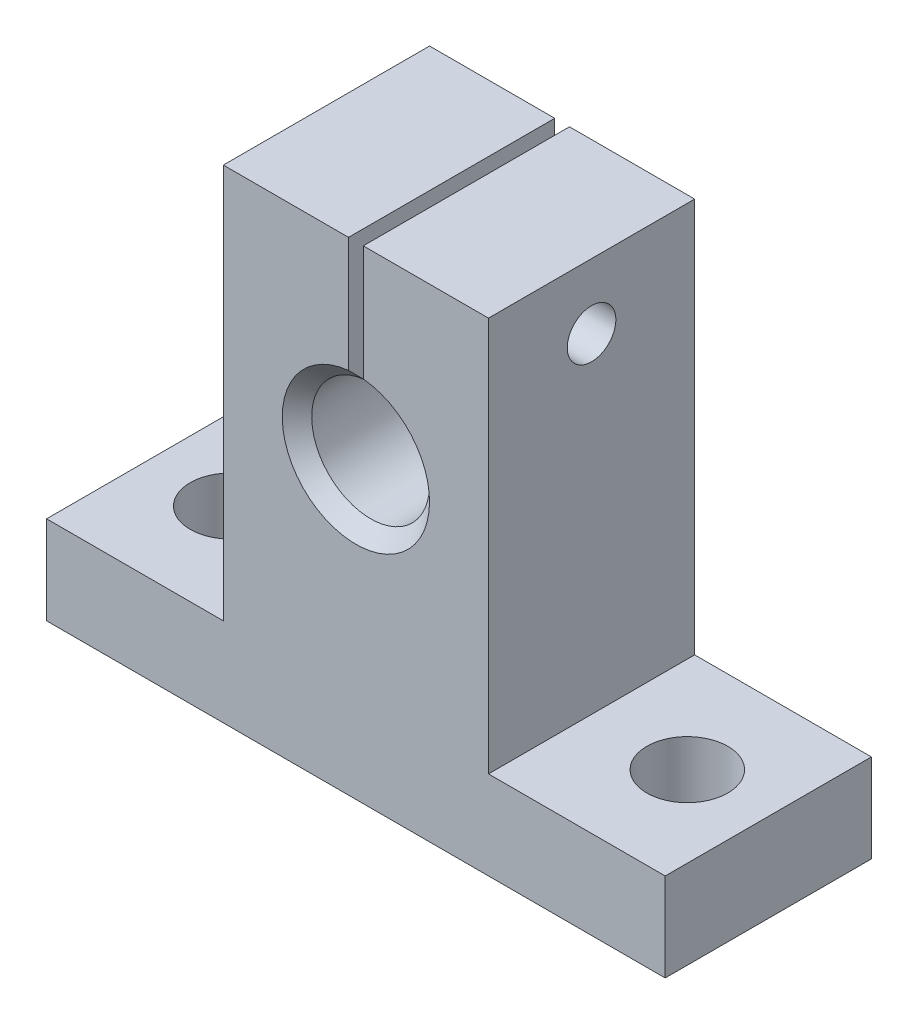
from build123d import *

# Parameters (mm, degrees)
BOSS_EXTRUDE1_DEPTH                                 = 14
SKETCH2_R                                           = 4
CUT_EXTRUDE1_DEPTH                                  = 42.386471219
SKETCH3_W                                           = 1
SKETCH3_H                                           = 15
CUT_EXTRUDE2_DEPTH                                  = 42.386471219
SKETCH4_R                                           = 2.75
CUT_EXTRUDE3_DEPTH                                  = 37.813584449
CHAMFER1_SIZE                                       = 1
CBORE_FOR_M4_HEX_SOCKET_HEAD_CAP_SCREW1_D           = 4.5
CBORE_FOR_M4_HEX_SOCKET_HEAD_CAP_SCREW1_DEPTH       = 10.1
CBORE_FOR_M4_HEX_SOCKET_HEAD_CAP_SCREW1_CBORE_D     = 7.5
CBORE_FOR_M4_HEX_SOCKET_HEAD_CAP_SCREW1_CBORE_DEPTH = 4.4
CBORE_FOR_M4_HEX_SOCKET_HEAD_CAP_SCREW1_TIP         = 1.351936393
M4_TAPPED_HOLE1_D                                   = 3.3
M4_TAPPED_HOLE1_DEPTH                               = 10.1
M4_TAPPED_HOLE1_TIP                                 = 0.991420021
CUT_EXTRUDE5_DEPTH                                  = 1


with BuildPart() as part:
    # Sketch1 → Boss-Extrude1 (new body)
    with BuildSketch(Plane.XY):
        Polygon((21, 0), (-21, 0), (-21, 6), (-9, 6), (-9, 32.8), (9, 32.8), (9, 6), (21, 6), align=None)
    extrude(amount=BOSS_EXTRUDE1_DEPTH)

    # Sketch2 → Cut-Extrude1 (cut, through all)
    with BuildSketch(Plane.XY.offset(14)):
        with Locations((0, 20)):
            Circle(SKETCH2_R)
    extrude(amount=-CUT_EXTRUDE1_DEPTH, mode=Mode.SUBTRACT)

    # Sketch3 → Cut-Extrude2 (cut, through all)
    with BuildSketch(Plane.XY.offset(14)):
        with Locations((0, 28.4)):
            Rectangle(SKETCH3_W, SKETCH3_H)
    extrude(amount=-CUT_EXTRUDE2_DEPTH, mode=Mode.SUBTRACT)

    # Sketch4 → Cut-Extrude3 (cut, through all)
    with BuildSketch(Plane(origin=(0, 6, 0), x_dir=(1, 0, 0), z_dir=(0, 1, 0))):
        with Locations(Location((-15.5, -7, 0), (0, 0, 270))):
            Circle(SKETCH4_R)
        with Locations(Location((15.5, -7, 0), (0, 0, 90))):
            Circle(SKETCH4_R)
    extrude(amount=-CUT_EXTRUDE3_DEPTH, mode=Mode.SUBTRACT)

    # Chamfer1
    chamfer1_edges = [part.edges().sort_by_distance(p)[0] for p in [
        (0, 16, 0),
        (0, 16, 14),
    ]]
    chamfer(chamfer1_edges, length=CHAMFER1_SIZE)

    # CBORE for M4 Hex Socket Head Cap Screw1
    with Locations(Plane.ZY.offset(9)):
        with Locations((7, 28.384313483)):
            CounterBoreHole(CBORE_FOR_M4_HEX_SOCKET_HEAD_CAP_SCREW1_D / 2, CBORE_FOR_M4_HEX_SOCKET_HEAD_CAP_SCREW1_CBORE_D / 2, CBORE_FOR_M4_HEX_SOCKET_HEAD_CAP_SCREW1_CBORE_DEPTH, depth=CBORE_FOR_M4_HEX_SOCKET_HEAD_CAP_SCREW1_DEPTH)
            with Locations((0, 0, -(CBORE_FOR_M4_HEX_SOCKET_HEAD_CAP_SCREW1_DEPTH + CBORE_FOR_M4_HEX_SOCKET_HEAD_CAP_SCREW1_TIP / 2))):  # 118° drill point
                Cone(0, CBORE_FOR_M4_HEX_SOCKET_HEAD_CAP_SCREW1_D / 2, CBORE_FOR_M4_HEX_SOCKET_HEAD_CAP_SCREW1_TIP, mode=Mode.SUBTRACT)

    # M4 Tapped Hole1
    with Locations(Plane.ZY.offset(-0.5)):
        with Locations((7, 28.384313483)):
            Hole(M4_TAPPED_HOLE1_D / 2, depth=M4_TAPPED_HOLE1_DEPTH)
            with Locations((0, 0, -(M4_TAPPED_HOLE1_DEPTH + M4_TAPPED_HOLE1_TIP / 2))):  # 118° drill point
                Cone(0, M4_TAPPED_HOLE1_D / 2, M4_TAPPED_HOLE1_TIP, mode=Mode.SUBTRACT)

    # Sketch13 → Cut-Extrude5 (cut)
    # profile 1 of 3: a face of its own
    with BuildSketch(Plane.ZY.offset(9)):
        with BuildLine():
            Line((3.096153846, 11.716348379), (3.392027244, 11.893732193))
            add(Edge.make_bspline(
                [(3.392027244, 11.893732193), (3.419545481, 11.847667808), (3.472269361, 11.759410224), (3.560220721, 11.640152184), (3.651353632, 11.538790027), (3.746342965, 11.45591342), (3.844608913, 11.390664533), (3.946792967, 11.344462301), (4.052550778, 11.315646326), (4.124524599, 11.312146239), (4.160456731, 11.31039886)],
                knots=[0, 0, 0, 0, 1.272034388, 2.437168799, 3.508375237, 4.49857839, 5.41946034, 6.295179144, 7.148887113, 8, 8, 8, 8], degree=3))
            add(Edge.make_bspline(
                [(4.160456731, 11.31039886), (4.191143591, 11.311253532), (4.251980364, 11.312947923), (4.341542607, 11.329228725), (4.42852441, 11.354240854), (4.511133047, 11.390061785), (4.588228662, 11.433400271), (4.655835357, 11.485746448), (4.71428147, 11.544352654), (4.762090585, 11.609735309), (4.79877062, 11.680052457), (4.826962689, 11.752228409), (4.842607762, 11.827396977), (4.844964516, 11.87800744), (4.846153846, 11.903547898)],
                knots=[0, 0, 0, 0, 1.095163259, 2.171163733, 3.241058638, 4.321873601, 5.38011039, 6.391990106, 7.366004449, 8.327778327, 9.272591725, 10.192022065, 11.087607919, 12, 12, 12, 12], degree=3))
            add(Edge.make_bspline(
                [(4.846153846, 11.903547898), (4.844679535, 11.932688748), (4.841682477, 11.991927837), (4.816350997, 12.07932749), (4.77650175, 12.16582006), (4.739739107, 12.219321326), (4.720653045, 12.247097578)],
                knots=[0, 0, 0, 0, 0.938893495, 1.908633276, 2.914225137, 4, 4, 4, 4], degree=3))
            add(Edge.make_bspline(
                [(4.720653045, 12.247097578), (4.704982431, 12.267144401), (4.672083936, 12.3092302), (4.615526424, 12.371875436), (4.54916031, 12.436493854), (4.475256755, 12.505552911), (4.391123666, 12.575840708), (4.299396151, 12.650708986), (4.197732292, 12.727310563), (4.126432796, 12.778683129), (4.089643429, 12.805190527)],
                knots=[0, 0, 0, 0, 0.722233717, 1.516239348, 2.393582979, 3.351407094, 4.387010283, 5.505090956, 6.712668013, 8, 8, 8, 8], degree=3))
            add(Edge.make_bspline(
                [(4.089643429, 12.805190527), (4.052819433, 12.831419114), (3.982414757, 12.881566176), (3.883956174, 12.95599046), (3.795911711, 13.02403433), (3.718672695, 13.086338342), (3.652273098, 13.142910947), (3.596189687, 13.193208886), (3.55185113, 13.238592447), (3.527195549, 13.268033789), (3.516125801, 13.281252225)],
                knots=[0, 0, 0, 0, 1.452282411, 2.77665338, 3.964542531, 5.026858415, 5.96415736, 6.766646006, 7.446254459, 8, 8, 8, 8], degree=3))
            add(Edge.make_bspline(
                [(3.516125801, 13.281252225), (3.500653256, 13.301853262), (3.470224419, 13.342367966), (3.430058414, 13.405692824), (3.395919251, 13.470516089), (3.369156919, 13.537011954), (3.3466207, 13.604246883), (3.331462769, 13.673098128), (3.321971372, 13.743256747), (3.320999386, 13.790470247), (3.320512821, 13.814104789)],
                knots=[0, 0, 0, 0, 1.068054152, 2.10047183, 3.106115577, 4.101338837, 5.06977816, 6.043150881, 7.020423561, 8, 8, 8, 8], degree=3))
            add(Edge.make_bspline(
                [(3.320512821, 13.814104789), (3.32181803, 13.851134564), (3.32440055, 13.924402628), (3.346241067, 14.031433458), (3.38071396, 14.133619875), (3.429008848, 14.229950209), (3.491266201, 14.31791619), (3.563312176, 14.398529677), (3.649123662, 14.466298259), (3.743276285, 14.525510318), (3.846332657, 14.571856243), (3.954323561, 14.606817223), (4.067420633, 14.626626481), (4.144023767, 14.629469246), (4.182892628, 14.63091168)],
                knots=[0, 0, 0, 0, 1.005424448, 1.989358655, 2.955360095, 3.929531133, 4.905563448, 5.876582895, 6.856512386, 7.866279853, 8.892233794, 9.918561126, 10.94386622, 12, 12, 12, 12], degree=3))
            add(Edge.make_bspline(
                [(4.182892628, 14.63091168), (4.224136729, 14.629489129), (4.30615808, 14.626660128), (4.426807296, 14.602062596), (4.542968012, 14.561361925), (4.636411277, 14.515173267), (4.709544039, 14.469041851), (4.765316771, 14.427022027), (4.821834222, 14.378646918), (4.879552277, 14.323787672), (4.937492936, 14.261940921), (4.996516388, 14.193530232), (5.056760657, 14.118973676), (5.095516517, 14.065749175), (5.115384615, 14.038463764)],
                knots=[0, 0, 0, 0, 1.286793592, 2.559021753, 3.825965368, 5.121522368, 5.803751409, 6.523245864, 7.299691795, 8.125521123, 9.008227632, 9.944561021, 10.946284179, 12, 12, 12, 12], degree=3))
            Line((5.115384615, 14.038463764), (4.831430288, 13.823219373))
            add(Edge.make_bspline(
                [(4.831430288, 13.823219373), (4.814284356, 13.845308063), (4.781265299, 13.887845716), (4.731135812, 13.947417032), (4.683887164, 14.001833512), (4.637336764, 14.04909864), (4.593943133, 14.091800773), (4.551826091, 14.12836053), (4.511591739, 14.159136125), (4.460874829, 14.191979685), (4.39715711, 14.224536189), (4.317172574, 14.252085267), (4.233586299, 14.268640329), (4.176656668, 14.270829216), (4.147836538, 14.271937321)],
                knots=[0, 0, 0, 0, 1.181633172, 2.275549214, 3.290209073, 4.226197932, 5.078386478, 5.862611352, 6.581680152, 7.217281963, 8.414376989, 9.595101626, 10.782541182, 12, 12, 12, 12], degree=3))
            add(Edge.make_bspline(
                [(4.147836538, 14.271937321), (4.111680016, 14.270725622), (4.041955569, 14.268388972), (3.942965333, 14.242868987), (3.853871407, 14.202687127), (3.777318842, 14.146372149), (3.713581865, 14.079651156), (3.667476407, 14.002872301), (3.639726242, 13.918089898), (3.636339962, 13.858948242), (3.634615385, 13.828828347)],
                knots=[0, 0, 0, 0, 1.14458467, 2.207223713, 3.21896685, 4.227309161, 5.202851033, 6.127160689, 7.046193047, 8, 8, 8, 8], degree=3))
            add(Edge.make_bspline(
                [(3.634615385, 13.828828347), (3.635008511, 13.810076869), (3.635795407, 13.772543249), (3.646770205, 13.717091827), (3.660869534, 13.661780488), (3.683212166, 13.606857905), (3.714057469, 13.551363546), (3.754562645, 13.494341808), (3.805575957, 13.4352901), (3.84465297, 13.396882726), (3.865284455, 13.376604789)],
                knots=[0, 0, 0, 0, 0.858281714, 1.717966888, 2.583508476, 3.4729293, 4.427298488, 5.488583878, 6.674047936, 8, 8, 8, 8], degree=3))
            add(Edge.make_bspline(
                [(3.865284455, 13.376604789), (3.872945828, 13.369767764), (3.891147495, 13.353524555), (3.92442342, 13.326932275), (3.968366219, 13.294129502), (4.02182842, 13.253542186), (4.085795782, 13.206460724), (4.160275338, 13.153487112), (4.244436871, 13.092901653), (4.304158786, 13.050544112), (4.335737179, 13.028147257)],
                knots=[0, 0, 0, 0, 0.420754252, 0.999615792, 1.744751191, 2.668019286, 3.750313428, 4.999500688, 6.413464383, 8, 8, 8, 8], degree=3))
            add(Edge.make_bspline(
                [(4.335737179, 13.028147257), (4.373723093, 13.000505898), (4.447277549, 12.946982236), (4.551935129, 12.866566556), (4.646828937, 12.787918787), (4.732292141, 12.71154118), (4.809169049, 12.638013087), (4.87660677, 12.566449907), (4.93529245, 12.497364334), (4.998471669, 12.408791759), (5.063029488, 12.300010674), (5.118470996, 12.166732436), (5.153429343, 12.032936115), (5.158000859, 11.943009279), (5.16025641, 11.898640046)],
                knots=[0, 0, 0, 0, 1.163667725, 2.253281268, 3.268753668, 4.215851969, 5.092017293, 5.902905408, 6.650798638, 7.335211899, 8.59617414, 9.77448103, 10.901945474, 12, 12, 12, 12], degree=3))
            add(Edge.make_bspline(
                [(5.16025641, 11.898640046), (5.159599272, 11.867261681), (5.158297757, 11.805114297), (5.143336843, 11.71385922), (5.121417178, 11.625228351), (5.088379944, 11.540317238), (5.048056786, 11.457572475), (4.996890538, 11.379164575), (4.937582853, 11.303358176), (4.869549088, 11.232174685), (4.795103186, 11.166828489), (4.716419491, 11.108699428), (4.633369218, 11.060231104), (4.546402902, 11.020680262), (4.455500565, 10.989746745), (4.360692781, 10.967333876), (4.26182327, 10.953578165), (4.194622788, 10.952150403), (4.160456731, 10.951424501)],
                knots=[0, 0, 0, 0, 0.983748083, 1.948392443, 2.894712957, 3.844097841, 4.80183111, 5.778335162, 6.776009319, 7.81870978, 8.863265674, 9.881300176, 10.883814829, 11.87499822, 12.874611388, 13.892143829, 14.928324115, 16, 16, 16, 16], degree=3))
            add(Edge.make_bspline(
                [(4.160456731, 10.951424501), (4.134021388, 10.951935683), (4.081483628, 10.952951608), (4.003774146, 10.961932888), (3.927634557, 10.974639992), (3.854020275, 10.994814062), (3.781982863, 11.019291039), (3.711835628, 11.049429372), (3.643544575, 11.085546573), (3.576726992, 11.126841598), (3.511552817, 11.174899342), (3.448633349, 11.230872839), (3.385904164, 11.293218344), (3.325216767, 11.363628907), (3.265343623, 11.44096699), (3.207465214, 11.525956173), (3.150383496, 11.618133527), (3.114568028, 11.682998613), (3.096153846, 11.716348379)],
                knots=[0, 0, 0, 0, 0.915332311, 1.819136955, 2.706846663, 3.586547465, 4.459518054, 5.340707479, 6.227863349, 7.133153174, 8.059268498, 9.028702269, 10.047606654, 11.120612155, 12.245963614, 13.433783089, 14.680604001, 16, 16, 16, 16], degree=3))
        make_face()
    # profile 2 of 3: a face of its own
    with BuildSketch(Plane.ZY.offset(9)):
        Polygon((5.878205128, 14.541168091), (6.192307692, 14.541168091), (6.192307692, 13.208335559), (7.651342147, 14.541168091), (8.099358974, 14.541168091), (6.379507212, 12.97065527), (8.233974359, 11.041168091), (7.815404647, 11.041168091), (6.192307692, 12.730170495), (6.192307692, 11.041168091), (5.878205128, 11.041168091), align=None)
    # profile 3 of 3: a face of its own
    with BuildSketch(Plane.ZY.offset(9)):
        with BuildLine():
            add(Edge.make_bspline(
                [(10.137520032, 12.990987802), (10.166168579, 12.976049846), (10.222042814, 12.946915843), (10.301620022, 12.900005016), (10.374345023, 12.850564051), (10.442235585, 12.800928191), (10.504098936, 12.74919654), (10.559243349, 12.695163384), (10.609030969, 12.640177438), (10.652457753, 12.583307598), (10.690654589, 12.524704949), (10.723666725, 12.464215676), (10.751883927, 12.401972342), (10.774246866, 12.337295512), (10.792668658, 12.271135251), (10.805344263, 12.202637269), (10.812161181, 12.132252928), (10.813449994, 12.084684626), (10.814102564, 12.06059918)],
                knots=[0, 0, 0, 0, 1.272397273, 2.481599622, 3.635517121, 4.734568067, 5.792894095, 6.808321871, 7.773003508, 8.711915296, 9.623354172, 10.525449501, 11.423591555, 12.311487226, 13.218079475, 14.126165749, 15.051214107, 16, 16, 16, 16], degree=3))
            add(Edge.make_bspline(
                [(10.814102564, 12.06059918), (10.813331144, 12.026901448), (10.811804213, 11.960200991), (10.798504229, 11.86175488), (10.77859125, 11.766143098), (10.749511738, 11.673386607), (10.711798347, 11.583997233), (10.665321511, 11.49789846), (10.612710306, 11.413679151), (10.570458067, 11.361859749), (10.549078526, 11.335639245)],
                knots=[0, 0, 0, 0, 1.025265484, 2.029385089, 3.018602448, 3.995076438, 4.983346944, 5.966715145, 6.97116228, 8, 8, 8, 8], degree=3))
            add(Edge.make_bspline(
                [(10.549078526, 11.335639245), (10.521242051, 11.30504547), (10.465913086, 11.244235978), (10.371130158, 11.165285168), (10.267108274, 11.098935774), (10.154249942, 11.044863879), (10.03285684, 11.00277802), (9.902954836, 10.972535502), (9.764290683, 10.955213073), (9.668985212, 10.952709083), (9.620092147, 10.951424501)],
                knots=[0, 0, 0, 0, 0.954267603, 1.896743057, 2.838368354, 3.796610408, 4.779680527, 5.799409237, 6.871065594, 8, 8, 8, 8], degree=3))
            add(Edge.make_bspline(
                [(9.620092147, 10.951424501), (9.573078759, 10.952576979), (9.48159548, 10.954819584), (9.348437602, 10.970014016), (9.224314532, 10.996641882), (9.108504564, 11.033086492), (9.001705871, 11.08049672), (8.90422277, 11.139505129), (8.814648797, 11.207736571), (8.735702324, 11.287150649), (8.66561388, 11.372208521), (8.604045827, 11.459960131), (8.552871748, 11.550413489), (8.509544653, 11.642219856), (8.47637663, 11.73666601), (8.45340442, 11.833266023), (8.438815106, 11.931851166), (8.436873971, 11.998382819), (8.435897436, 12.031853187)],
                knots=[0, 0, 0, 0, 1.256902934, 2.445805442, 3.576955095, 4.645999104, 5.686449165, 6.692658513, 7.68621702, 8.689161843, 9.678783111, 10.630372946, 11.551080876, 12.453998257, 13.34127905, 14.221779781, 15.105423033, 16, 16, 16, 16], degree=3))
            add(Edge.make_bspline(
                [(8.435897436, 12.031853187), (8.436475317, 12.056412379), (8.437617414, 12.104950011), (8.445522262, 12.176659339), (8.458230723, 12.246455474), (8.47549018, 12.314596217), (8.498881207, 12.38058549), (8.52712334, 12.444735964), (8.560055292, 12.507120063), (8.598136457, 12.568078944), (8.642438481, 12.626758456), (8.692602131, 12.684154451), (8.74963, 12.739376318), (8.812887659, 12.793098743), (8.881652198, 12.846274716), (8.957709729, 12.896030445), (9.039043996, 12.94588841), (9.096849402, 12.975696735), (9.126502404, 12.990987802)],
                knots=[0, 0, 0, 0, 0.941657376, 1.861047343, 2.762797495, 3.66048619, 4.553285746, 5.444104102, 6.34607688, 7.256116206, 8.197091036, 9.162375105, 10.176350973, 11.237807142, 12.343728897, 13.50695164, 14.721116704, 16, 16, 16, 16], degree=3))
            add(Edge.make_bspline(
                [(9.126502404, 12.990987802), (9.085911029, 13.013122571), (9.007314766, 13.055981678), (8.903245325, 13.134728484), (8.813854702, 13.220016299), (8.741599984, 13.313646094), (8.684727756, 13.412692968), (8.645709151, 13.516537221), (8.619312667, 13.623253334), (8.61669784, 13.696159531), (8.615384615, 13.732774661)],
                knots=[0, 0, 0, 0, 1.166880483, 2.259407225, 3.286803203, 4.280235371, 5.237608625, 6.161067461, 7.076446754, 8, 8, 8, 8], degree=3))
            add(Edge.make_bspline(
                [(8.615384615, 13.732774661), (8.617020039, 13.77007222), (8.620307527, 13.845046816), (8.646890848, 13.95665294), (8.690210914, 14.066269505), (8.749131911, 14.173365218), (8.822519127, 14.274315432), (8.910565673, 14.364856379), (9.01116897, 14.444167861), (9.123826837, 14.510744034), (9.245063073, 14.564927693), (9.372978797, 14.602306115), (9.50534529, 14.626742232), (9.595443009, 14.629508887), (9.641125801, 14.63091168)],
                knots=[0, 0, 0, 0, 0.888701115, 1.786444228, 2.72001202, 3.692817113, 4.693886446, 5.687152267, 6.695133018, 7.739871481, 8.800368666, 9.853104506, 10.91144658, 12, 12, 12, 12], degree=3))
            add(Edge.make_bspline(
                [(9.641125801, 14.63091168), (9.685629616, 14.629465337), (9.773386069, 14.626613313), (9.902380697, 14.602826435), (10.025805574, 14.563096916), (10.143235073, 14.509199692), (10.252566941, 14.442812752), (10.34916925, 14.362411877), (10.434501832, 14.272270327), (10.505086226, 14.171350723), (10.563249116, 14.06466653), (10.603750017, 13.953044009), (10.629701991, 13.83889495), (10.632975355, 13.761656946), (10.634615385, 13.722958956)],
                knots=[0, 0, 0, 0, 1.072916533, 2.115669174, 3.151510826, 4.193348718, 5.225979165, 6.227137561, 7.216255879, 8.211077061, 9.189680878, 10.138522389, 11.067357538, 12, 12, 12, 12], degree=3))
            add(Edge.make_bspline(
                [(10.634615385, 13.722958956), (10.633180824, 13.684982292), (10.630363428, 13.610398283), (10.606663489, 13.501671762), (10.566750175, 13.399849723), (10.512256012, 13.303776771), (10.441230525, 13.215195274), (10.354621792, 13.132978804), (10.253120314, 13.056451975), (10.176859427, 13.013265611), (10.137520032, 12.990987802)],
                knots=[0, 0, 0, 0, 0.975232327, 1.915300861, 2.843280834, 3.77672583, 4.742871857, 5.749627742, 6.839139064, 8, 8, 8, 8], degree=3))
        make_face()
        with BuildLine():
            add(Edge.make_bspline(
                [(9.623597756, 14.271937321), (9.599046951, 14.271285881), (9.551014839, 14.270011378), (9.480586168, 14.263352741), (9.413613801, 14.250399525), (9.349398, 14.233160813), (9.288819188, 14.209872825), (9.231054634, 14.182477816), (9.177087444, 14.14917175), (9.126266141, 14.111810552), (9.080515366, 14.070717646), (9.039910815, 14.027903927), (9.0061827, 13.982528535), (8.977541591, 13.935720176), (8.956760073, 13.886089599), (8.94119577, 13.835158423), (8.930674378, 13.782283039), (8.929885988, 13.746146528), (8.929487179, 13.727866809)],
                knots=[0, 0, 0, 0, 1.203892937, 2.355340988, 3.463153438, 4.544400666, 5.610487187, 6.640501085, 7.674077295, 8.714426146, 9.728707835, 10.68524104, 11.601827946, 12.495867327, 13.368432065, 14.231010473, 15.105153427, 16, 16, 16, 16], degree=3))
            add(Edge.make_bspline(
                [(8.929487179, 13.727866809), (8.930174546, 13.709586299), (8.931532882, 13.673461386), (8.94203801, 13.62011552), (8.957694865, 13.567693883), (8.982345526, 13.517442972), (9.011911885, 13.467619613), (9.048403361, 13.419469027), (9.091892389, 13.372823642), (9.140919829, 13.328080201), (9.194331367, 13.286181438), (9.25091541, 13.249808257), (9.309961801, 13.219374146), (9.370863871, 13.194044741), (9.434242318, 13.174354804), (9.499708791, 13.160386157), (9.567274294, 13.151704161), (9.613054875, 13.150667139), (9.636217949, 13.15014245)],
                knots=[0, 0, 0, 0, 0.873023192, 1.725219244, 2.590779336, 3.480155217, 4.391973325, 5.357036234, 6.360879153, 7.436073238, 8.526419356, 9.601555421, 10.645666583, 11.697338044, 12.750135903, 13.812665442, 14.89329948, 16, 16, 16, 16], degree=3))
            add(Edge.make_bspline(
                [(9.636217949, 13.15014245), (9.665968053, 13.151015317), (9.72517442, 13.15275243), (9.812453752, 13.168903604), (9.897316396, 13.194309521), (9.978855301, 13.229069488), (10.054959886, 13.272697347), (10.122799954, 13.324930366), (10.181796847, 13.384562463), (10.231337457, 13.450665298), (10.269747304, 13.521016887), (10.299649111, 13.59161718), (10.317110327, 13.663219411), (10.319387894, 13.711186374), (10.320512821, 13.734878027)],
                knots=[0, 0, 0, 0, 1.076279235, 2.141928126, 3.20205304, 4.278698113, 5.344010996, 6.36967002, 7.368914609, 8.37248503, 9.349703398, 10.264243087, 11.142681841, 12, 12, 12, 12], degree=3))
            add(Edge.make_bspline(
                [(10.320512821, 13.734878027), (10.319980923, 13.751506063), (10.318925182, 13.78451033), (10.310225127, 13.833248696), (10.295849294, 13.880878279), (10.276386213, 13.92779255), (10.250776419, 13.973333282), (10.220412231, 14.01821637), (10.18352773, 14.061432134), (10.142131296, 14.103987682), (10.095185888, 14.143371706), (10.042781975, 14.178006416), (9.985188225, 14.207418773), (9.922403275, 14.231307528), (9.854658351, 14.249249877), (9.782265477, 14.262686225), (9.70462103, 14.270259337), (9.651191279, 14.271365862), (9.623597756, 14.271937321)],
                knots=[0, 0, 0, 0, 0.814439003, 1.616544685, 2.417341072, 3.248991801, 4.09997495, 4.973547432, 5.9003056, 6.880240646, 7.880314356, 8.896779544, 9.951930927, 11.043077905, 12.18215768, 13.381699519, 14.647792085, 16, 16, 16, 16], degree=3))
        make_face(mode=Mode.SUBTRACT)
        with BuildLine():
            add(Edge.make_bspline(
                [(9.643930288, 12.791168091), (9.612804503, 12.790614449), (9.551743306, 12.78952834), (9.462286378, 12.77743884), (9.376433213, 12.760609447), (9.294473276, 12.735078608), (9.21644118, 12.701882118), (9.141914497, 12.661947578), (9.071463367, 12.614742135), (9.006060641, 12.560865519), (8.946337312, 12.502806065), (8.893939012, 12.44134393), (8.849441491, 12.377621397), (8.81360824, 12.310829168), (8.784196508, 12.242381557), (8.764882631, 12.170573962), (8.752500919, 12.096786849), (8.750838288, 12.04662675), (8.75, 12.02133636)],
                knots=[0, 0, 0, 0, 1.140299081, 2.23698856, 3.303958914, 4.344563908, 5.37730929, 6.408454204, 7.439741482, 8.480804886, 9.510774543, 10.48932336, 11.43758569, 12.353841022, 13.263987381, 14.161954604, 15.073269652, 16, 16, 16, 16], degree=3))
            add(Edge.make_bspline(
                [(8.75, 12.02133636), (8.751363259, 11.989905454), (8.754067932, 11.92754727), (8.775524571, 11.835384199), (8.809960107, 11.746163144), (8.857985323, 11.660611192), (8.917452895, 11.580661085), (8.990579363, 11.51097231), (9.072820201, 11.449050831), (9.166958055, 11.398970298), (9.269786521, 11.358975443), (9.38127825, 11.33141948), (9.499833169, 11.31317803), (9.581692761, 11.311339849), (9.623597756, 11.31039886)],
                knots=[0, 0, 0, 0, 0.898778495, 1.783155532, 2.693654817, 3.627872908, 4.583023416, 5.533784346, 6.509005473, 7.520592997, 8.575161974, 9.658835044, 10.801527049, 12, 12, 12, 12], degree=3))
            add(Edge.make_bspline(
                [(9.623597756, 11.31039886), (9.656348124, 11.311027668), (9.720156343, 11.312252789), (9.813242292, 11.323067083), (9.901086841, 11.340216708), (9.983519639, 11.365160254), (10.061463479, 11.39561023), (10.133596833, 11.434782312), (10.20177536, 11.479334635), (10.262639483, 11.532192791), (10.318072692, 11.588672286), (10.366405984, 11.648462329), (10.408363535, 11.709937961), (10.441294491, 11.774488446), (10.467620745, 11.840875361), (10.4865443, 11.909710872), (10.498220515, 11.981206105), (10.499401411, 12.029705176), (10.5, 12.054289084)],
                knots=[0, 0, 0, 0, 1.224942928, 2.386581632, 3.501229538, 4.569074225, 5.605009692, 6.626002462, 7.634866581, 8.645888296, 9.63523824, 10.59253846, 11.518950513, 12.414518923, 13.29783783, 14.186679152, 15.080837789, 16, 16, 16, 16], degree=3))
            add(Edge.make_bspline(
                [(10.5, 12.054289084), (10.499094151, 12.078166425), (10.497307976, 12.12524837), (10.485971285, 12.195014896), (10.466055408, 12.26241771), (10.438728011, 12.328267716), (10.402347048, 12.391230667), (10.359502178, 12.452946838), (10.30780806, 12.511703283), (10.249395464, 12.567956379), (10.185736503, 12.619972116), (10.118069358, 12.665986554), (10.046914896, 12.704738671), (9.972423685, 12.736255166), (9.894761129, 12.761042636), (9.813984351, 12.778358631), (9.729998776, 12.789258234), (9.672943905, 12.790524279), (9.643930288, 12.791168091)],
                knots=[0, 0, 0, 0, 0.917430815, 1.809013306, 2.70690318, 3.612392954, 4.541220862, 5.495268465, 6.494511384, 7.542276156, 8.608045339, 9.649016899, 10.681629292, 11.715607085, 12.752076957, 13.808767841, 14.885711793, 16, 16, 16, 16], degree=3))
        make_face(mode=Mode.SUBTRACT)
    extrude(amount=-CUT_EXTRUDE5_DEPTH, mode=Mode.SUBTRACT)


solid = part.part
